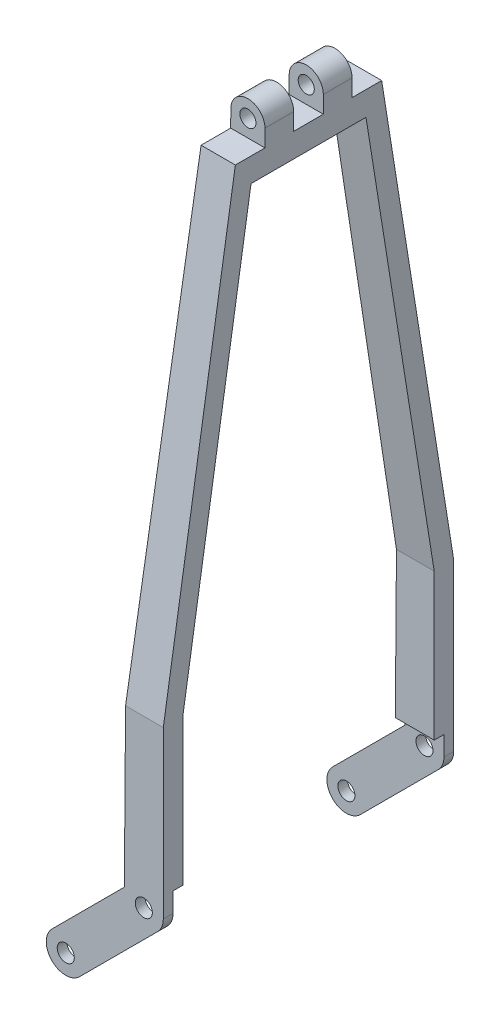
from build123d import *

# Parameters (mm, degrees)
CROQUIS1_R              = 1.75
CROQUIS1_R_2            = 1.65
SALIENTE_EXTRUIR1_DEPTH = 59.54
CROQUIS2_W              = 3.035
CROQUIS2_H              = 7
CROQUIS2_W_2            = 6.07
CORTAR_EXTRUIR1_DEPTH   = 149.131714596


with BuildPart() as part:
    # Croquis1 → Saliente-Extruir1 (new body)
    with BuildSketch(Plane.XY):
        with BuildLine():
            Line((-13.171572875, -18.828427125), (2.828427125, -2.828427125))
            ThreePointArc((2.828427125, -2.828427125), (3.69551813, -1.530733729), (4, 0))
            Line((4, 0), (4, 129.999038458))
            ThreePointArc((4, 129.999038458), (0.513461538, 133.49901257), (-2.99989645, 130.025961336))
            Line((-2.99989645, 130.025961336), (-3.987275146, 1.669579104))
            Line((-3.987275146, 1.669579104), (-18.828427125, -13.171572875))
            ThreePointArc((-18.828427125, -13.171572875), (-18.828427125, -18.828427125), (-13.171572875, -18.828427125))
        make_face()
        Circle(CROQUIS1_R, mode=Mode.SUBTRACT)
        with Locations((-16, -16)):
            Circle(CROQUIS1_R, mode=Mode.SUBTRACT)
        with Locations((0.5, 129.999038458)):
            Circle(CROQUIS1_R_2, mode=Mode.SUBTRACT)
    extrude(amount=-SALIENTE_EXTRUIR1_DEPTH)

    # Croquis2 → Cortar-Extruir1 (cut, through all)
    with BuildSketch(Plane(origin=(4, 0, 0), x_dir=(0, 0, -1), z_dir=(1, 0, 0))):
        Polygon((2, 4), (2, -20), (57.54, -20), (57.54, 4), (55.54, 4), (4, 4), align=None)
        with Locations((28.2525, 129.999038458)):
            Rectangle(CROQUIS2_W, CROQUIS2_H)
        with Locations((31.2875, 129.999038458)):
            Rectangle(CROQUIS2_W, CROQUIS2_H)
        Polygon((4, 34), (4, 4), (55.54, 4), (55.54, 34), (29.77, 34), align=None)
        Polygon((17.984568448, 121.580171608), (4, 34), (29.77, 34), (29.77, 121.580171608), align=None)
        Polygon((29.77, 34), (55.54, 34), (41.555431552, 121.580171608), (29.77, 121.580171608), align=None)
        Polygon((14.77, 126.499038458), (14.77, 133.499038458), (0, 133.499038458), (0, 34), align=None)
        with Locations((17.805, 129.999038458)):
            Rectangle(CROQUIS2_W_2, CROQUIS2_H)
        Polygon((44.77, 126.499038458), (59.54, 34), (59.54, 133.499038458), (44.77, 133.499038458), align=None)
        with Locations((41.735, 129.999038458)):
            Rectangle(CROQUIS2_W_2, CROQUIS2_H)
    extrude(amount=-CORTAR_EXTRUIR1_DEPTH, mode=Mode.SUBTRACT)


solid = part.part
